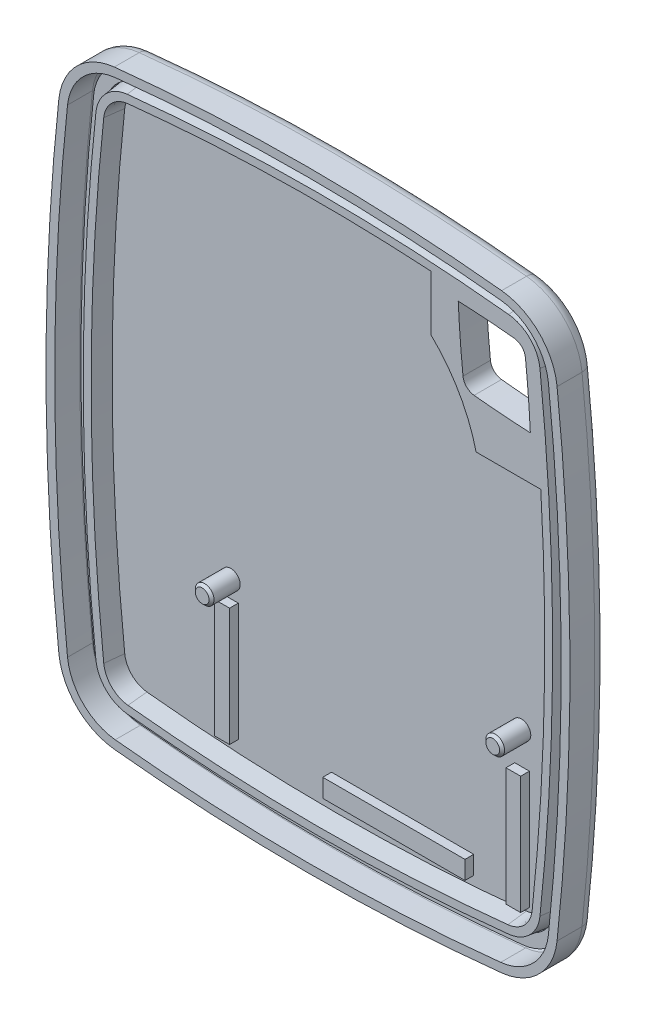
from build123d import *

# Parameters (mm, degrees)
IZIM1_W                          = 42
IZIM1_H                          = 49
Y_KSEKLIK_EKSTR_ZYON1_DEPTH      = 1.5
KES_EKSTR_ZYON1_DEPTH            = 33.407560846
KES_EKSTR_ZYON2_DEPTH            = 33.407560846
RADYUS1_R                        = 5
RADYUS2_R                        = 1
BO_ALTMA1_T                      = -0.7
Y_KSEKLIK_EKSTR_ZYON2_DEPTH      = 1.5
Y_KSEKLIK_EKSTR_ZYON2_DRAFT      = 7
Y_KSEKLIK_EKSTR_ZYON3_DEPTH      = 0.5
Y_KSEKLIK_EKSTR_ZYON8_DEPTH      = 2.3
Y_KSEKLIK_EKSTR_ZYON8_DEPTH_BACK = 0.2
IZIM8_R                          = 0.75
Y_KSEKLIK_EKSTR_ZYON15_DEPTH     = 1.5
KES_EKSTR_ZYON3_DEPTH            = 10.4
KES_EKSTR_ZYON3_DEPTH_BACK       = 33.350270626
PAH3_SIZE                        = 0.2
IZIM23_W                         = 1.195139298
IZIM23_H                         = 9.469532353
IZIM23_W_2                       = 1.174622946
IZIM23_W_3                       = 11.401786042
IZIM23_H_2                       = 1.465664101
Y_KSEKLIK_EKSTR_ZYON16_DEPTH     = 0.7


with BuildPart() as part:
    # Çizim1 → Yükseklik-Ekstrüzyon1 (new, symmetric)
    with BuildSketch(Plane.XY):
        Rectangle(IZIM1_W, IZIM1_H)
    extrude(amount=Y_KSEKLIK_EKSTR_ZYON1_DEPTH, both=True)

    # Çizim2 → Kes-Ekstrüzyon1 (cut, through all)
    with BuildSketch(Plane.XY.offset(1.5)):
        with BuildLine():
            Line((21, 24.5), (0, 24.5))
            ThreePointArc((0, 24.5), (10.526751636, 24.1245229), (21, 23))
            Line((21, 23), (21, 24.5))
        make_face()
        with BuildLine():
            Line((0, 24.5), (-21, 24.5))
            Line((-21, 24.5), (-21, 23))
            ThreePointArc((-21, 23), (-10.526751636, 24.1245229), (0, 24.5))
        make_face()
        with BuildLine():
            ThreePointArc((0, -24.5), (-10.526751636, -24.1245229), (-21, -23))
            Line((-21, -23), (-21, -24.5))
            Line((-21, -24.5), (0, -24.5))
        make_face()
        with BuildLine():
            Line((21, -24.5), (21, -23))
            ThreePointArc((21, -23), (10.526751636, -24.1245229), (0, -24.5))
            Line((0, -24.5), (21, -24.5))
        make_face()
    extrude(amount=-KES_EKSTR_ZYON1_DEPTH, mode=Mode.SUBTRACT)

    # Çizim3 → Kes-Ekstrüzyon2 (cut, through all)
    with BuildSketch(Plane.XY.offset(1.5)):
        with BuildLine():
            Line((21, -7.77e-07), (21, 23))
            ThreePointArc((21, 23), (20.250265893, 23.105694222), (19.5, 23.207545043))
            ThreePointArc((19.5, 23.207545043), (20.624609193, 11.62798468), (21, -7.77e-07))
        make_face()
        with BuildLine():
            Line((21, -23), (21, -7.77e-07))
            ThreePointArc((21, -7.77e-07), (20.624609143, -11.627985455), (19.5, -23.207545043))
            ThreePointArc((19.5, -23.207545043), (20.250265893, -23.105694222), (21, -23))
        make_face()
        with BuildLine():
            ThreePointArc((-21, -23), (-20.250265893, -23.105694222), (-19.5, -23.207545043))
            ThreePointArc((-19.5, -23.207545043), (-20.624609168, -11.627985067), (-21, 0))
            Line((-21, 0), (-21, -23))
        make_face()
        with BuildLine():
            ThreePointArc((-21, 0), (-20.624609168, 11.627985067), (-19.5, 23.207545043))
            ThreePointArc((-19.5, 23.207545043), (-20.250265893, 23.105694222), (-21, 23))
            Line((-21, 23), (-21, 0))
        make_face()
    extrude(amount=-KES_EKSTR_ZYON2_DEPTH, mode=Mode.SUBTRACT)

    # Radyus1
    radyus1_edges = [part.edges().sort_by_distance(p)[0] for p in [
        (19.5, 23.207545043, 0),
        (19.5, -23.207545043, 0),
        (-19.5, -23.207545043, 0),
        (-19.5, 23.207545043, 0),
    ]]
    fillet(radyus1_edges, radius=RADYUS1_R)

    # Radyus2
    radyus2_edges = [part.edges().sort_by_distance(p)[0] for p in [
        (-21, 0, -1.5),
        (0, -24.5, -1.5),
        (0, 24.5, -1.5),
        (21, 0, -1.5),
        (18.53112444, 22.248381304, -1.5),
        (-18.53112444, 22.248381304, -1.5),
        (18.53112444, -22.248381304, -1.5),
        (-18.53112444, -22.248381304, -1.5),
    ]]
    fillet(radyus2_edges, radius=RADYUS2_R)

    # İç Boşaltma1
    bo_altma1_openings = [part.faces().sort_by_distance(p)[0] for p in [
        (0, 0, 1.5),
    ]]
    offset(amount=BO_ALTMA1_T, openings=bo_altma1_openings)


with BuildPart() as y_kseklik_ekstr_zyon2_tool:
    # Çizim4 → Yükseklik-Ekstrüzyon2 (with draft: the straight prism first)
    with BuildSketch(Plane.XY.offset(-0.8)):
        with BuildLine():
            ThreePointArc((15.313774029, 21.693267608), (0, 22.5), (-15.313774029, 21.693267608))
            ThreePointArc((-15.313774029, 21.693267608), (-17.118101745, 20.832977876), (-17.98142772, 19.030100955))
            ThreePointArc((-17.98142772, 19.030100955), (-19, 0), (-17.98142772, -19.030100955))
            ThreePointArc((-17.98142772, -19.030100955), (-17.118101745, -20.832977876), (-15.313774029, -21.693267608))
            ThreePointArc((-15.313774029, -21.693267608), (0, -22.5), (15.313774029, -21.693267608))
            ThreePointArc((15.313774029, -21.693267608), (17.118101745, -20.832977876), (17.98142772, -19.030100955))
            ThreePointArc((17.98142772, -19.030100955), (19, 0), (17.98142772, 19.030100955))
            ThreePointArc((17.98142772, 19.030100955), (17.118101745, 20.832977876), (15.313774029, 21.693267608))
        make_face()
        with BuildLine():
            ThreePointArc((15.208705253, 20.698802651), (0, 21.5), (-15.208705253, 20.698802651))
            ThreePointArc((-15.208705253, 20.698802651), (-16.411590397, 20.125276162), (-16.987141048, 18.923358215))
            ThreePointArc((-16.987141048, 18.923358215), (-18, 0), (-16.987141048, -18.923358215))
            ThreePointArc((-16.987141048, -18.923358215), (-16.411590397, -20.125276162), (-15.208705253, -20.698802651))
            ThreePointArc((-15.208705253, -20.698802651), (0, -21.5), (15.208705253, -20.698802651))
            ThreePointArc((15.208705253, -20.698802651), (16.411590397, -20.125276162), (16.987141048, -18.923358215))
            ThreePointArc((16.987141048, -18.923358215), (18, 0), (16.987141048, 18.923358215))
            ThreePointArc((16.987141048, 18.923358215), (16.411590397, 20.125276162), (15.208705253, 20.698802651))
        make_face(mode=Mode.SUBTRACT)
    extrude(amount=Y_KSEKLIK_EKSTR_ZYON2_DEPTH)
    # Yükseklik-Ekstrüzyon2: the draft: its side faces are tilted about the plane it starts from
    y_kseklik_ekstr_zyon2_sides = [y_kseklik_ekstr_zyon2_tool.faces().sort_by_distance(p)[0] for p in [
        (0, 22.5, -0.05),
        (-17.118101745, 20.832977876, -0.05),
        (-19, 0, -0.05),
        (-17.118101745, -20.832977876, -0.05),
        (0, -22.5, -0.05),
        (17.118101745, -20.832977876, -0.05),
        (19, 0, -0.05),
        (17.118101745, 20.832977876, -0.05),
        (18, 0, -0.05),
        (16.411590397, -20.125276162, -0.05),
        (0, -21.5, -0.05),
        (-16.411590397, -20.125276162, -0.05),
        (-18, 0, -0.05),
        (-16.411590397, 20.125276162, -0.05),
        (0, 21.5, -0.05),
        (16.411590397, 20.125276162, -0.05),
    ]]
    draft(y_kseklik_ekstr_zyon2_sides, Plane.XY.offset(-0.8), Y_KSEKLIK_EKSTR_ZYON2_DRAFT)


with BuildPart() as part_1:
    add(part.part)

    # Yükseklik-Ekstrüzyon2: add y_kseklik_ekstr_zyon2_tool
    add(y_kseklik_ekstr_zyon2_tool.part)

    # Çizim5 → Yükseklik-Ekstrüzyon3 (add)
    with BuildSketch(Plane.XY.offset(-0.8)):
        with BuildLine():
            ThreePointArc((15.418842804, 22.687732566), (0, 23.5), (-15.418842804, 22.687732566))
            ThreePointArc((-15.418842804, 22.687732566), (-17.824613093, 21.54067959), (-18.975714393, 19.136843696))
            ThreePointArc((-18.975714393, 19.136843696), (-20, 0), (-18.975714393, -19.136843696))
            ThreePointArc((-18.975714393, -19.136843696), (-17.824613093, -21.54067959), (-15.418842804, -22.687732566))
            ThreePointArc((-15.418842804, -22.687732566), (0, -23.5), (15.418842804, -22.687732566))
            ThreePointArc((15.418842804, -22.687732566), (17.824613093, -21.54067959), (18.975714393, -19.136843696))
            ThreePointArc((18.975714393, -19.136843696), (20, 0), (18.975714393, 19.136843696))
            ThreePointArc((18.975714393, 19.136843696), (17.824613093, 21.54067959), (15.418842804, 22.687732566))
        make_face()
        with BuildLine():
            ThreePointArc((15.313774029, -21.693267608), (17.118101745, -20.832977876), (17.98142772, -19.030100955))
            ThreePointArc((17.98142772, -19.030100955), (19, 0), (17.98142772, 19.030100955))
            ThreePointArc((17.98142772, 19.030100955), (17.118101745, 20.832977876), (15.313774029, 21.693267608))
            ThreePointArc((15.313774029, 21.693267608), (0, 22.5), (-15.313774029, 21.693267608))
            ThreePointArc((-15.313774029, 21.693267608), (-17.118101745, 20.832977876), (-17.98142772, 19.030100955))
            ThreePointArc((-17.98142772, 19.030100955), (-19, 0), (-17.98142772, -19.030100955))
            ThreePointArc((-17.98142772, -19.030100955), (-17.118101745, -20.832977876), (-15.313774029, -21.693267608))
            ThreePointArc((-15.313774029, -21.693267608), (0, -22.5), (15.313774029, -21.693267608))
        make_face(mode=Mode.SUBTRACT)
    extrude(amount=Y_KSEKLIK_EKSTR_ZYON3_DEPTH)

    # Çizim8 → Yükseklik-Ekstrüzyon8 (add, two sides: drawn at the far end of the back side and taken through both)
    with BuildSketch(Plane.XY.offset(-0.8).offset(-Y_KSEKLIK_EKSTR_ZYON8_DEPTH_BACK)):
        with Locations(Location((14.812425531, -8.309982201, 0), (0, 0, 180))):
            Circle(IZIM8_R)
        with Locations(Location((-8.480882924, -9.506259894, 0), (0, 0, 180))):
            Circle(IZIM8_R)
    extrude(amount=Y_KSEKLIK_EKSTR_ZYON8_DEPTH + Y_KSEKLIK_EKSTR_ZYON8_DEPTH_BACK)

    # Çizim16 → Yükseklik-Ekstrüzyon15 (add)
    with BuildSketch(Plane.XY.offset(-0.8)):
        with BuildLine():
            Line((9.048859794, 21.401421538), (9.048859794, 16.992843773))
            ThreePointArc((9.048859794, 16.992843773), (11.317756668, 14.084998399), (12.680076466, 10.657529579))
            Line((12.680076466, 10.657529579), (18.186401203, 10.657529579))
            Line((18.186401203, 10.657529579), (18.063866322, 12.795203017))
            Line((18.063866322, 12.795203017), (17.374341633, 19.636753116))
            Line((17.374341633, 19.636753116), (15.877211927, 21.133882821))
            Line((15.877211927, 21.133882821), (9.704278839, 21.640855305))
            Line((9.704278839, 21.640855305), (9.048859794, 21.401421538))
        make_face()
    extrude(amount=Y_KSEKLIK_EKSTR_ZYON15_DEPTH)

    # Çizim6 → Kes-Ekstrüzyon3 (cut, two sides: drawn at the far end of the back side and taken through both)
    with BuildSketch(Plane.XY.offset(-0.8).offset(-KES_EKSTR_ZYON3_DEPTH_BACK)):
        with BuildLine():
            ThreePointArc((17.027314601, 14.164071789), (16.865312311, 16.682390917), (16.63168801, 19.195077857))
            ThreePointArc((16.63168801, 19.195077857), (16.343912685, 19.796036831), (15.742470113, 20.082800075))
            ThreePointArc((15.742470113, 20.082800075), (13.496657201, 20.284756909), (11.245642959, 20.41665492))
            ThreePointArc((11.245642959, 20.41665492), (11.401700182, 17.90498215), (11.628994453, 15.398751659))
            ThreePointArc((11.628994453, 15.398751659), (11.915382838, 14.7971305), (12.51616236, 14.508980728))
            ThreePointArc((12.51616236, 14.508980728), (14.769042696, 14.301267405), (17.027314601, 14.164071789))
        make_face()
    extrude(amount=KES_EKSTR_ZYON3_DEPTH + KES_EKSTR_ZYON3_DEPTH_BACK, mode=Mode.SUBTRACT)

    # Pah3
    pah3_edges = [part_1.edges().sort_by_distance(p)[0] for p in [
        (15.562425531, -8.309982201, 1.5),
        (-7.730882924, -9.506259894, 1.5),
    ]]
    chamfer(pah3_edges, length=PAH3_SIZE)

    # Çizim23 → Yükseklik-Ekstrüzyon16 (add)
    with BuildSketch(Plane.XY.offset(-0.8)):
        with Locations((-8.480984996, -15.599774908)):
            Rectangle(IZIM23_W, IZIM23_H)
        with Locations((14.86155624, -15.599774908)):
            Rectangle(IZIM23_W_2, IZIM23_H)
        with Locations((5.286851787, -19.601709034)):
            Rectangle(IZIM23_W_3, IZIM23_H_2)
    extrude(amount=Y_KSEKLIK_EKSTR_ZYON16_DEPTH)


solid = part_1.part
